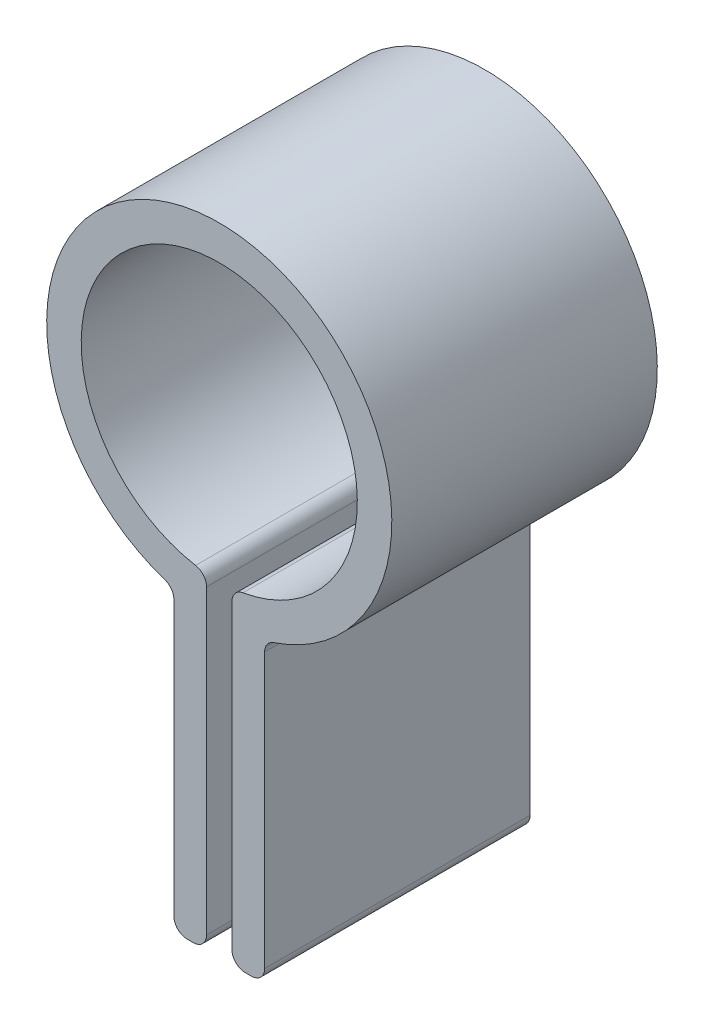
from build123d import *

# Parameters (mm, degrees)
BOSS_EXTRUDE1_DEPTH = 10


with BuildPart() as part:
    # Sketch1 → Boss-Extrude1 (new body)
    with BuildSketch(Plane.XY):
        with BuildLine():
            Line((0.478661478, -5.615355885), (0.478661478, -16.97170584))
            ThreePointArc((0.478661478, -16.97170584), (0.625108087, -17.325259231), (0.978661478, -17.47170584))
            Line((0.978661478, -17.47170584), (1.209808881, -17.47170584))
            ThreePointArc((1.209808881, -17.47170584), (1.563362272, -17.325259231), (1.709808881, -16.97170584))
            Line((1.709808881, -16.97170584), (1.709808881, -6.642043715))
            ThreePointArc((1.709808881, -6.642043715), (1.804271123, -6.349572986), (2.05196539, -6.167612021))
            ThreePointArc((2.05196539, -6.167612021), (0, 6.5), (-2.05196539, -6.167612021))
            ThreePointArc((-2.05196539, -6.167612021), (-1.804271123, -6.349572986), (-1.709808881, -6.642043715))
            Line((-1.709808881, -6.642043715), (-1.709808881, -16.97170584))
            ThreePointArc((-1.709808881, -16.97170584), (-1.563362272, -17.325259231), (-1.209808881, -17.47170584))
            Line((-1.209808881, -17.47170584), (-0.978661478, -17.47170584))
            ThreePointArc((-0.978661478, -17.47170584), (-0.625108087, -17.325259231), (-0.478661478, -16.97170584))
            Line((-0.478661478, -16.97170584), (-0.478661478, -5.615355885))
            ThreePointArc((-0.478661478, -5.615355885), (-0.595958101, -5.293582478), (-0.89281398, -5.122780807))
            ThreePointArc((-0.89281398, -5.122780807), (0, 5.2), (0.89281398, -5.122780807))
            ThreePointArc((0.89281398, -5.122780807), (0.595958101, -5.293582478), (0.478661478, -5.615355885))
        make_face()
    extrude(amount=BOSS_EXTRUDE1_DEPTH)


solid = part.part
